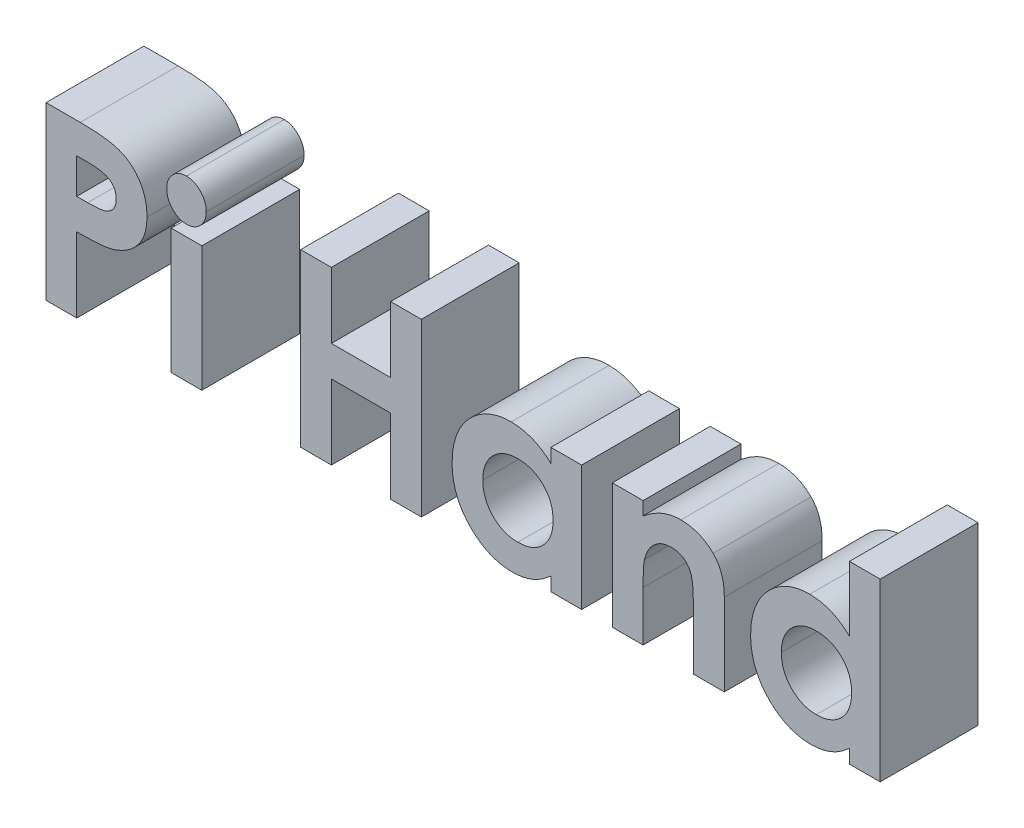
from build123d import *

# Parameters (mm, degrees)
BOSS_EXTRUDE1_DEPTH   = 2
BOSS_EXTRUDE1_2_DEPTH = 2
SKETCH1_W             = 0.628205128
SKETCH1_H             = 2.557692308
BOSS_EXTRUDE1_3_DEPTH = 2
BOSS_EXTRUDE1_4_DEPTH = 2
BOSS_EXTRUDE1_5_DEPTH = 2
BOSS_EXTRUDE1_6_DEPTH = 2
BOSS_EXTRUDE1_7_DEPTH = 2


with BuildPart() as part:
    # Sketch1 → Boss-Extrude1 (new body)
    with BuildSketch(Plane.XY):
        with BuildLine():
            Line((0.403846154, 3.5), (1.104967949, 3.5))
            add(Edge.make_bspline(
                [(1.104967949, 3.5), (1.150778337, 3.499794943), (1.239156179, 3.499399345), (1.366604298, 3.494602193), (1.484181429, 3.486005403), (1.591860556, 3.475381131), (1.689597407, 3.460486316), (1.777514377, 3.443410575), (1.85562971, 3.422607354), (1.924824273, 3.397914219), (1.986924158, 3.368801977), (2.045690679, 3.337795361), (2.099795705, 3.300790059), (2.15197008, 3.261774345), (2.199230906, 3.217021062), (2.244526596, 3.169508606), (2.285938753, 3.117352673), (2.323659267, 3.061184597), (2.357877585, 3.002042122), (2.387772997, 2.93981952), (2.412022481, 2.87441833), (2.432364783, 2.806261623), (2.448703918, 2.735352371), (2.459579766, 2.661254473), (2.466967189, 2.584485311), (2.467619027, 2.532236171), (2.467948718, 2.505809295)],
                knots=[0, 0, 0, 0, 1.698747864, 3.27724071, 4.728299578, 6.070144658, 7.288476769, 8.393259625, 9.389771311, 10.283485332, 11.113357557, 11.931608583, 12.74405601, 13.541433047, 14.344816069, 15.154114104, 15.974336324, 16.810834471, 17.661136416, 18.50621059, 19.367396281, 20.244825668, 21.142564693, 22.063065223, 23.020325768, 24, 24, 24, 24], degree=3))
            add(Edge.make_bspline(
                [(2.467948718, 2.505809295), (2.467471697, 2.476573871), (2.466534292, 2.419122669), (2.457344706, 2.334906257), (2.441645989, 2.254613532), (2.421128587, 2.177567372), (2.39251853, 2.105035358), (2.359832882, 2.035286853), (2.319619169, 1.970277391), (2.273668572, 1.909193782), (2.223485278, 1.851539387), (2.167877937, 1.798978868), (2.10790645, 1.751153923), (2.04391797, 1.707563341), (1.975672265, 1.668295054), (1.903218577, 1.632981357), (1.826062152, 1.602751692), (1.772332739, 1.586941821), (1.745092147, 1.578926282)],
                knots=[0, 0, 0, 0, 1.102006807, 2.165578795, 3.188629044, 4.184801286, 5.166646146, 6.124351954, 7.085497154, 8.042432466, 9.003981491, 9.963833307, 10.922997304, 11.89326795, 12.880200226, 13.889073926, 14.929769137, 16, 16, 16, 16], degree=3))
            add(Edge.make_bspline(
                [(1.745092147, 1.578926282), (1.727149927, 1.574462228), (1.688281298, 1.564791651), (1.623964394, 1.554973587), (1.549845916, 1.545946482), (1.465686188, 1.538188777), (1.371436693, 1.532915346), (1.267188687, 1.52879703), (1.152894927, 1.52580259), (1.073419566, 1.525696334), (1.032051282, 1.525641026)],
                knots=[0, 0, 0, 0, 0.618981996, 1.340914327, 2.176866532, 3.120127938, 4.170906482, 5.338178032, 6.614476169, 8, 8, 8, 8], degree=3))
            Line((1.032051282, 1.525641026), (1.032051282, 0))
            Line((1.032051282, 0), (0.403846154, 0))
            Line((0.403846154, 0), (0.403846154, 3.5))
        make_face()
        with BuildLine():
            Line((1.032051282, 2.153846154), (1.254306891, 2.153846154))
            add(Edge.make_bspline(
                [(1.254306891, 2.153846154), (1.294749808, 2.154102593), (1.369165376, 2.154574446), (1.470790763, 2.161397707), (1.55245888, 2.171818204), (1.616978208, 2.186763608), (1.667922329, 2.209445236), (1.711858443, 2.235683609), (1.749543571, 2.268861312), (1.782173344, 2.306772514), (1.808259865, 2.350334385), (1.826349508, 2.398837605), (1.838100185, 2.451263069), (1.839185469, 2.487747722), (1.83974359, 2.506510417)],
                knots=[0, 0, 0, 0, 1.8619151, 3.425951444, 4.686033666, 5.651700536, 6.461346321, 7.243864085, 7.999046032, 8.762387399, 9.539336099, 10.322741239, 11.137448474, 12, 12, 12, 12], degree=3))
            add(Edge.make_bspline(
                [(1.83974359, 2.506510417), (1.83919121, 2.522903138), (1.83811946, 2.554708959), (1.830246092, 2.600612649), (1.817698208, 2.643404356), (1.799516806, 2.68263718), (1.77601256, 2.718244457), (1.747356126, 2.750212159), (1.713915225, 2.779224904), (1.688096894, 2.794581793), (1.674979968, 2.802383814)],
                knots=[0, 0, 0, 0, 1.102301479, 2.1387299, 3.123554645, 4.094223062, 5.036071848, 5.982632524, 6.975082478, 8, 8, 8, 8], degree=3))
            add(Edge.make_bspline(
                [(1.674979968, 2.802383814), (1.663869174, 2.808002861), (1.640345348, 2.819899535), (1.60028199, 2.833730288), (1.554049488, 2.845398051), (1.501335718, 2.855082183), (1.442350972, 2.862598074), (1.377105774, 2.868345851), (1.305504108, 2.870657256), (1.255709434, 2.871405207), (1.229767628, 2.871794872)],
                knots=[0, 0, 0, 0, 0.656809284, 1.390599849, 2.23162475, 3.173112763, 4.218524733, 5.370385145, 6.63003504, 8, 8, 8, 8], degree=3))
            Line((1.229767628, 2.871794872), (1.032051282, 2.871794872))
            Line((1.032051282, 2.871794872), (1.032051282, 2.153846154))
        make_face(mode=Mode.SUBTRACT)
    extrude(amount=BOSS_EXTRUDE1_DEPTH)


with BuildPart() as body_2:
    # Sketch1 → Boss-Extrude1 2 (new body)
    with BuildSketch(Plane.XY):
        with BuildLine():
            add(Edge.make_bspline(
                [(3.274238782, 3.634615385), (3.301314419, 3.633286951), (3.35448004, 3.630678445), (3.430647027, 3.605251308), (3.500552884, 3.565344177), (3.562351601, 3.510590642), (3.613749995, 3.445204906), (3.653020277, 3.372001228), (3.674896115, 3.29089391), (3.677934345, 3.234865823), (3.679487179, 3.206229968)],
                knots=[0, 0, 0, 0, 0.989868614, 1.943702388, 2.910836514, 3.924849579, 4.949916355, 5.946401046, 6.950409252, 8, 8, 8, 8], degree=3))
            add(Edge.make_bspline(
                [(3.679487179, 3.206229968), (3.677989903, 3.177805144), (3.675072389, 3.12241802), (3.652516791, 3.042411771), (3.614822682, 2.969243648), (3.563007993, 2.904829012), (3.501879255, 2.850957315), (3.433500894, 2.810325694), (3.358063808, 2.786313063), (3.305723156, 2.7834865), (3.279146635, 2.782051282)],
                knots=[0, 0, 0, 0, 1.05296456, 2.051751585, 3.055639087, 4.085634717, 5.099016424, 6.062201612, 7.016062274, 8, 8, 8, 8], degree=3))
            add(Edge.make_bspline(
                [(3.279146635, 2.782051282), (3.25183465, 2.783374966), (3.19820649, 2.785974073), (3.121414777, 2.811460703), (3.050576554, 2.85105354), (2.98904592, 2.906925775), (2.937058899, 2.972776125), (2.899503959, 3.047684049), (2.876012415, 3.129345977), (2.873223989, 3.186203877), (2.871794872, 3.215344551)],
                knots=[0, 0, 0, 0, 0.989065327, 1.942068821, 2.907541208, 3.917690034, 4.939857478, 5.938239964, 6.943311734, 8, 8, 8, 8], degree=3))
            add(Edge.make_bspline(
                [(2.871794872, 3.215344551), (2.873350142, 3.243286705), (2.876405246, 3.298175033), (2.898412123, 3.377479097), (2.936781938, 3.449452107), (2.987810104, 3.513640896), (3.04906602, 3.567373072), (3.118929913, 3.606068197), (3.194584293, 3.630445121), (3.247413129, 3.633210943), (3.274238782, 3.634615385)],
                knots=[0, 0, 0, 0, 1.038616768, 2.040212704, 3.031499824, 4.052181184, 5.074969369, 6.039807101, 7.004644834, 8, 8, 8, 8], degree=3))
        make_face()
    extrude(amount=BOSS_EXTRUDE1_2_DEPTH)


with BuildPart() as body_3:
    # Sketch1 → Boss-Extrude1 3 (new body)
    with BuildSketch(Plane.XY):
        with Locations((3.275641026, 1.278846154)):
            Rectangle(SKETCH1_W, SKETCH1_H)
    extrude(amount=BOSS_EXTRUDE1_3_DEPTH)


with BuildPart() as body_4:
    # Sketch1 → Boss-Extrude1 4 (new body)
    with BuildSketch(Plane.XY):
        Polygon((5.608974359, 3.5), (6.237179487, 3.5), (6.237179487, 2.153846154), (7.448717949, 2.153846154), (7.448717949, 3.5), (8.076923077, 3.5), (8.076923077, 0), (7.448717949, 0), (7.448717949, 1.525641026), (6.237179487, 1.525641026), (6.237179487, 0), (5.608974359, 0), align=None)
    extrude(amount=BOSS_EXTRUDE1_4_DEPTH)


with BuildPart() as body_5:
    # Sketch1 → Boss-Extrude1 5 (new body)
    with BuildSketch(Plane.XY):
        with BuildLine():
            Line((10.724358974, 2.557692308), (11.352564103, 2.557692308))
            Line((11.352564103, 2.557692308), (11.352564103, 0))
            Line((11.352564103, 0), (10.724358974, 0))
            Line((10.724358974, 0), (10.724358974, 0.279046474))
            add(Edge.make_bspline(
                [(10.724358974, 0.279046474), (10.693231642, 0.251884388), (10.632819636, 0.199168144), (10.537629863, 0.130767476), (10.442161935, 0.074345765), (10.345957125, 0.029408949), (10.247536807, -0.003772264), (10.146192392, -0.027796237), (10.040464414, -0.041963762), (9.968591991, -0.043892353), (9.932091346, -0.044871795)],
                knots=[0, 0, 0, 0, 1.129196829, 2.191548051, 3.199897424, 4.157751732, 5.089409408, 6.034969131, 7.002052659, 8, 8, 8, 8], degree=3))
            add(Edge.make_bspline(
                [(9.932091346, -0.044871795), (9.89111775, -0.043950017), (9.810151602, -0.042128532), (9.691342768, -0.022954463), (9.576621028, 0.006395724), (9.466079503, 0.047929908), (9.359919313, 0.101750066), (9.257328011, 0.166451958), (9.160064326, 0.244307005), (9.067318569, 0.331946618), (8.98240111, 0.428350817), (8.908165466, 0.532181523), (8.845590335, 0.641966128), (8.794325879, 0.757340645), (8.753999764, 0.878220396), (8.725253014, 1.004988774), (8.708292399, 1.137691055), (8.706193153, 1.228082651), (8.705128205, 1.273938301)],
                knots=[0, 0, 0, 0, 0.980476535, 1.937477201, 2.874147792, 3.812856188, 4.758993464, 5.720109578, 6.712210464, 7.737600662, 8.772720504, 9.783789959, 10.789002326, 11.793715968, 12.802552247, 13.835794126, 14.902098527, 16, 16, 16, 16], degree=3))
            add(Edge.make_bspline(
                [(8.705128205, 1.273938301), (8.706245871, 1.321421887), (8.708438299, 1.414566232), (8.724475772, 1.551251128), (8.752692036, 1.681162718), (8.79116694, 1.804480946), (8.840658223, 1.921227119), (8.900935299, 2.031592502), (8.972818181, 2.13528862), (9.05565046, 2.23055049), (9.145088976, 2.317862595), (9.240772378, 2.393874707), (9.341204385, 2.458450533), (9.446491724, 2.511169467), (9.55661936, 2.551907991), (9.67115251, 2.581691179), (9.790599622, 2.599562137), (9.871967962, 2.601555137), (9.913161058, 2.602564103)],
                knots=[0, 0, 0, 0, 1.136281865, 2.228943489, 3.287578264, 4.313574083, 5.316051562, 6.317280042, 7.318008486, 8.329309503, 9.333984563, 10.305318864, 11.248632312, 12.186624717, 13.117503092, 14.05354244, 15.014596925, 16, 16, 16, 16], degree=3))
            add(Edge.make_bspline(
                [(9.913161058, 2.602564103), (9.951319212, 2.601771359), (10.026820445, 2.600202805), (10.137796379, 2.583171311), (10.245427029, 2.557412387), (10.349125264, 2.520710555), (10.449741652, 2.474367027), (10.545545527, 2.416295131), (10.638632686, 2.348935605), (10.69543049, 2.296326387), (10.724358974, 2.26953125)],
                knots=[0, 0, 0, 0, 1.017011718, 2.012299608, 2.98747302, 3.965332399, 4.941441765, 5.936729654, 6.94912688, 8, 8, 8, 8], degree=3))
            Line((10.724358974, 2.26953125), (10.724358974, 2.557692308))
        make_face()
        with BuildLine():
            add(Edge.make_bspline(
                [(10.044971955, 2.019230769), (10.019939833, 2.018462697), (9.970878507, 2.016957326), (9.898727113, 2.007902416), (9.829772026, 1.99194726), (9.764505026, 1.968376944), (9.701953397, 1.939664864), (9.643066993, 1.903703457), (9.587359809, 1.861197838), (9.535159463, 1.813177067), (9.487571157, 1.76039346), (9.44654726, 1.702795109), (9.411683575, 1.641933961), (9.382197958, 1.577627029), (9.361092946, 1.509113362), (9.344377786, 1.437284886), (9.3357037, 1.3615548), (9.334131361, 1.309947091), (9.333333333, 1.283754006)],
                knots=[0, 0, 0, 0, 1.04836806, 2.054732945, 3.03993516, 4.00574415, 4.955904794, 5.917688631, 6.888591924, 7.88601754, 8.884115178, 9.859153345, 10.841239365, 11.818093293, 12.814750328, 13.83810466, 14.90274714, 16, 16, 16, 16], degree=3))
            add(Edge.make_bspline(
                [(9.333333333, 1.283754006), (9.334119171, 1.257323336), (9.335667655, 1.205242005), (9.344518037, 1.128873109), (9.360631717, 1.055995388), (9.384140969, 0.98719801), (9.412851219, 0.92155267), (9.447798049, 0.859362327), (9.490724109, 0.801726584), (9.538354131, 0.747281587), (9.591625359, 0.698664318), (9.647647757, 0.655496646), (9.707186547, 0.619378283), (9.769595776, 0.590187194), (9.834665371, 0.566398909), (9.903211108, 0.550644277), (9.974561495, 0.540572639), (10.023202938, 0.539170098), (10.047776442, 0.538461538)],
                knots=[0, 0, 0, 0, 1.099136573, 2.165835871, 3.191374663, 4.196217796, 5.183857741, 6.167377911, 7.154730987, 8.166690795, 9.170734848, 10.148332609, 11.103258353, 12.059567475, 13.009337315, 13.978056681, 14.978520572, 16, 16, 16, 16], degree=3))
            add(Edge.make_bspline(
                [(10.047776442, 0.538461538), (10.073274817, 0.539233916), (10.123265494, 0.540748197), (10.196594001, 0.549720472), (10.266475403, 0.565734128), (10.332618955, 0.58943939), (10.396034938, 0.617945374), (10.45615108, 0.653204068), (10.512315029, 0.695612148), (10.564811229, 0.744067028), (10.612913878, 0.797281645), (10.654505103, 0.855635307), (10.690732582, 0.917261705), (10.719223828, 0.98361791), (10.741849872, 1.053543), (10.758083537, 1.127470944), (10.766913709, 1.205481445), (10.768448651, 1.258726651), (10.769230769, 1.285857372)],
                knots=[0, 0, 0, 0, 1.050008698, 2.058587853, 3.036635738, 3.995319155, 4.947022481, 5.895997462, 6.858296291, 7.838991643, 8.833936038, 9.806048392, 10.784806122, 11.771666913, 12.772873988, 13.80724452, 14.882696879, 16, 16, 16, 16], degree=3))
            add(Edge.make_bspline(
                [(10.769230769, 1.285857372), (10.768458369, 1.312521457), (10.766949648, 1.36460416), (10.758045455, 1.440985838), (10.74169654, 1.513462175), (10.719536177, 1.58216639), (10.690538064, 1.646941393), (10.654283174, 1.707068983), (10.61314818, 1.764632355), (10.564512966, 1.81640935), (10.512301149, 1.86451338), (10.455311218, 1.905639009), (10.395338666, 1.941082217), (10.33201502, 1.970182458), (10.264753932, 1.991514038), (10.194753107, 2.0080303), (10.120920389, 2.016951892), (10.07070123, 2.018458747), (10.044971955, 2.019230769)],
                knots=[0, 0, 0, 0, 1.106611376, 2.161533483, 3.185006901, 4.184773755, 5.152708835, 6.122342771, 7.094156588, 8.082475533, 9.064254463, 10.03606828, 10.992420271, 11.951521816, 12.920622147, 13.915721683, 14.932141191, 16, 16, 16, 16], degree=3))
        make_face(mode=Mode.SUBTRACT)
    extrude(amount=BOSS_EXTRUDE1_5_DEPTH)


with BuildPart() as body_6:
    # Sketch1 → Boss-Extrude1 6 (new body)
    with BuildSketch(Plane.XY):
        with BuildLine():
            Line((11.980769231, 2.557692308), (12.608974359, 2.557692308))
            Line((12.608974359, 2.557692308), (12.608974359, 2.287059295))
            add(Edge.make_bspline(
                [(12.608974359, 2.287059295), (12.64481315, 2.314935445), (12.713308047, 2.368212186), (12.817432116, 2.436140303), (12.915712346, 2.491736739), (13.010339508, 2.534026233), (13.103094014, 2.564451706), (13.195478092, 2.586310593), (13.288867525, 2.600307439), (13.351647893, 2.601812285), (13.383012821, 2.602564103)],
                knots=[0, 0, 0, 0, 1.276643801, 2.439914479, 3.493451431, 4.44993799, 5.350072675, 6.235028322, 7.118224225, 8, 8, 8, 8], degree=3))
            add(Edge.make_bspline(
                [(13.383012821, 2.602564103), (13.414828318, 2.601704931), (13.477284812, 2.600018304), (13.569248558, 2.588221719), (13.657110986, 2.5667364), (13.741860037, 2.538209707), (13.822633111, 2.500556109), (13.900419726, 2.45584857), (13.973549054, 2.401391763), (14.018585332, 2.359920073), (14.041366186, 2.338942308)],
                knots=[0, 0, 0, 0, 1.048836932, 2.058954983, 3.049370783, 4.026390553, 5.001981509, 5.982488534, 6.97947532, 8, 8, 8, 8], degree=3))
            add(Edge.make_bspline(
                [(14.041366186, 2.338942308), (14.059637269, 2.319502053), (14.096313158, 2.280479265), (14.142465156, 2.213701279), (14.182068761, 2.140901052), (14.214518413, 2.061238809), (14.238497398, 1.974276857), (14.256944759, 1.881065574), (14.267295894, 1.781083044), (14.268573791, 1.71239599), (14.269230769, 1.677083333)],
                knots=[0, 0, 0, 0, 0.889584746, 1.785680191, 2.700364693, 3.65222533, 4.649950538, 5.707241244, 6.821271309, 8, 8, 8, 8], degree=3))
            Line((14.269230769, 1.677083333), (14.269230769, 0))
            Line((14.269230769, 0), (13.641025641, 0))
            Line((13.641025641, 0), (13.641025641, 1.110576923))
            add(Edge.make_bspline(
                [(13.641025641, 1.110576923), (13.64089279, 1.146802008), (13.640638204, 1.216220658), (13.638683553, 1.31556918), (13.634866934, 1.405293797), (13.631388186, 1.485557872), (13.62455802, 1.556076413), (13.618398466, 1.617295857), (13.608947228, 1.668660815), (13.596649633, 1.723911535), (13.575175005, 1.783067534), (13.541836691, 1.845398153), (13.499542365, 1.898349402), (13.450019496, 1.942292498), (13.393322777, 1.977055518), (13.330137307, 2.001513467), (13.260801834, 2.016756262), (13.212489691, 2.018384947), (13.18739984, 2.019230769)],
                knots=[0, 0, 0, 0, 1.49886392, 2.872294502, 4.110984203, 5.214877267, 6.195405875, 7.042225351, 7.75923308, 8.355011229, 9.382752534, 10.352059385, 11.267231453, 12.171456522, 13.078624015, 14.003401117, 14.963110155, 16, 16, 16, 16], degree=3))
            add(Edge.make_bspline(
                [(13.18739984, 2.019230769), (13.154769432, 2.017576073), (13.090938012, 2.014339164), (12.998618632, 1.989929922), (12.913824819, 1.948416985), (12.837249409, 1.890971429), (12.76962172, 1.820047771), (12.71392176, 1.735463173), (12.66823635, 1.639259079), (12.648590945, 1.569014464), (12.638421474, 1.532652244)],
                knots=[0, 0, 0, 0, 0.984188326, 1.925263693, 2.85911992, 3.81709677, 4.80007086, 5.801799564, 6.862098548, 8, 8, 8, 8], degree=3))
            add(Edge.make_bspline(
                [(12.638421474, 1.532652244), (12.635893957, 1.521232445), (12.630257085, 1.495763997), (12.62562147, 1.452737838), (12.619172994, 1.401691466), (12.616756909, 1.341701086), (12.612555602, 1.273050607), (12.611001758, 1.195649206), (12.609445134, 1.109648654), (12.609136483, 1.049580536), (12.608974359, 1.018028846)],
                knots=[0, 0, 0, 0, 0.543362196, 1.211806945, 2.009705693, 2.934833164, 4.000995085, 5.207458376, 6.533175157, 8, 8, 8, 8], degree=3))
            Line((12.608974359, 1.018028846), (12.608974359, 0))
            Line((12.608974359, 0), (11.980769231, 0))
            Line((11.980769231, 0), (11.980769231, 2.557692308))
        make_face()
    extrude(amount=BOSS_EXTRUDE1_6_DEPTH)


with BuildPart() as body_7:
    # Sketch1 → Boss-Extrude1 7 (new body)
    with BuildSketch(Plane.XY):
        with BuildLine():
            Line((16.826923077, 3.58974359), (17.455128205, 3.58974359))
            Line((17.455128205, 3.58974359), (17.455128205, 0))
            Line((17.455128205, 0), (16.826923077, 0))
            Line((16.826923077, 0), (16.826923077, 0.279046474))
            add(Edge.make_bspline(
                [(16.826923077, 0.279046474), (16.795795744, 0.251884388), (16.735383739, 0.199168144), (16.640193966, 0.130767476), (16.544726038, 0.074345765), (16.448521228, 0.029408949), (16.350100909, -0.003772264), (16.248756494, -0.027796237), (16.143028516, -0.041963762), (16.071156093, -0.043892353), (16.034655449, -0.044871795)],
                knots=[0, 0, 0, 0, 1.129196829, 2.191548051, 3.199897424, 4.157751732, 5.089409408, 6.034969131, 7.002052659, 8, 8, 8, 8], degree=3))
            add(Edge.make_bspline(
                [(16.034655449, -0.044871795), (15.993681853, -0.043950017), (15.912715704, -0.042128532), (15.793906871, -0.022954463), (15.67918513, 0.006395724), (15.568643605, 0.047929908), (15.462483415, 0.101750066), (15.359892114, 0.166451958), (15.262628428, 0.244307005), (15.169882671, 0.331946618), (15.084965212, 0.428350817), (15.010729568, 0.532181523), (14.948154438, 0.641966128), (14.896889981, 0.757340645), (14.856563866, 0.878220396), (14.827817117, 1.004988774), (14.810856501, 1.137691055), (14.808757255, 1.228082651), (14.807692308, 1.273938301)],
                knots=[0, 0, 0, 0, 0.980476535, 1.937477201, 2.874147792, 3.812856188, 4.758993464, 5.720109578, 6.712210464, 7.737600662, 8.772720504, 9.783789959, 10.789002326, 11.793715968, 12.802552247, 13.835794126, 14.902098527, 16, 16, 16, 16], degree=3))
            add(Edge.make_bspline(
                [(14.807692308, 1.273938301), (14.808809974, 1.321421887), (14.811002401, 1.414566232), (14.827039874, 1.551251128), (14.855256138, 1.681162718), (14.893731042, 1.804480946), (14.943222325, 1.921227119), (15.003499402, 2.031592502), (15.075382284, 2.13528862), (15.158214563, 2.23055049), (15.247653079, 2.317862595), (15.34333648, 2.393874707), (15.443768487, 2.458450533), (15.549055827, 2.511169467), (15.659183462, 2.551907991), (15.773716613, 2.581691179), (15.893163724, 2.599562137), (15.974532064, 2.601555137), (16.01572516, 2.602564103)],
                knots=[0, 0, 0, 0, 1.136281865, 2.228943489, 3.287578264, 4.313574083, 5.316051562, 6.317280042, 7.318008486, 8.329309503, 9.333984563, 10.305318864, 11.248632312, 12.186624717, 13.117503092, 14.05354244, 15.014596925, 16, 16, 16, 16], degree=3))
            add(Edge.make_bspline(
                [(16.01572516, 2.602564103), (16.053858714, 2.601354246), (16.129267819, 2.598961754), (16.240660056, 2.583901614), (16.347840544, 2.555544685), (16.452110986, 2.519008867), (16.55211723, 2.469844118), (16.648396565, 2.410785484), (16.741202671, 2.341082936), (16.797988381, 2.287180892), (16.826923077, 2.259715545)],
                knots=[0, 0, 0, 0, 1.011899165, 2.001030639, 2.974036179, 3.948778736, 4.92769327, 5.924124564, 6.942254589, 8, 8, 8, 8], degree=3))
            Line((16.826923077, 2.259715545), (16.826923077, 3.58974359))
        make_face()
        with BuildLine():
            add(Edge.make_bspline(
                [(16.147536058, 2.019230769), (16.122503935, 2.018462697), (16.073442609, 2.016957326), (16.001291216, 2.007902416), (15.932336128, 1.99194726), (15.867069129, 1.968376944), (15.804517499, 1.939664864), (15.745631096, 1.903703457), (15.689923911, 1.861197838), (15.637723566, 1.813177067), (15.59013526, 1.76039346), (15.549111362, 1.702795109), (15.514247677, 1.641933961), (15.484762061, 1.577627029), (15.463657049, 1.509113362), (15.446941888, 1.437284886), (15.438267802, 1.3615548), (15.436695464, 1.309947091), (15.435897436, 1.283754006)],
                knots=[0, 0, 0, 0, 1.04836806, 2.054732945, 3.03993516, 4.00574415, 4.955904794, 5.917688631, 6.888591924, 7.88601754, 8.884115178, 9.859153345, 10.841239365, 11.818093293, 12.814750328, 13.83810466, 14.90274714, 16, 16, 16, 16], degree=3))
            add(Edge.make_bspline(
                [(15.435897436, 1.283754006), (15.436683274, 1.257323336), (15.438231758, 1.205242005), (15.44708214, 1.128873109), (15.46319582, 1.055995388), (15.486705072, 0.98719801), (15.515415321, 0.92155267), (15.550362151, 0.859362327), (15.593288211, 0.801726584), (15.640918234, 0.747281587), (15.694189461, 0.698664318), (15.750211859, 0.655496646), (15.80975065, 0.619378283), (15.872159879, 0.590187194), (15.937229474, 0.566398909), (16.005775211, 0.550644277), (16.077125598, 0.540572639), (16.12576704, 0.539170098), (16.150340545, 0.538461538)],
                knots=[0, 0, 0, 0, 1.099136573, 2.165835871, 3.191374663, 4.196217796, 5.183857741, 6.167377911, 7.154730987, 8.166690795, 9.170734848, 10.148332609, 11.103258353, 12.059567475, 13.009337315, 13.978056681, 14.978520572, 16, 16, 16, 16], degree=3))
            add(Edge.make_bspline(
                [(16.150340545, 0.538461538), (16.17583892, 0.539233916), (16.225829597, 0.540748197), (16.299158103, 0.549720472), (16.369039505, 0.565734128), (16.435183058, 0.58943939), (16.498599041, 0.617945374), (16.558715182, 0.653204068), (16.614879131, 0.695612148), (16.667375332, 0.744067028), (16.71547798, 0.797281645), (16.757069206, 0.855635307), (16.793296685, 0.917261705), (16.82178793, 0.98361791), (16.844413974, 1.053543), (16.860647639, 1.127470944), (16.869477812, 1.205481445), (16.871012753, 1.258726651), (16.871794872, 1.285857372)],
                knots=[0, 0, 0, 0, 1.050008698, 2.058587853, 3.036635738, 3.995319155, 4.947022481, 5.895997462, 6.858296291, 7.838991643, 8.833936038, 9.806048392, 10.784806122, 11.771666913, 12.772873988, 13.80724452, 14.882696879, 16, 16, 16, 16], degree=3))
            add(Edge.make_bspline(
                [(16.871794872, 1.285857372), (16.871022472, 1.312521457), (16.86951375, 1.36460416), (16.860609557, 1.440985838), (16.844260642, 1.513462175), (16.822100279, 1.58216639), (16.793102166, 1.646941393), (16.756847276, 1.707068983), (16.715712283, 1.764632355), (16.667077069, 1.81640935), (16.614865252, 1.86451338), (16.557875321, 1.905639009), (16.497902769, 1.941082217), (16.434579123, 1.970182458), (16.367318034, 1.991514038), (16.29731721, 2.0080303), (16.223484491, 2.016951892), (16.173265333, 2.018458747), (16.147536058, 2.019230769)],
                knots=[0, 0, 0, 0, 1.106611376, 2.161533483, 3.185006901, 4.184773755, 5.152708835, 6.122342771, 7.094156588, 8.082475533, 9.064254463, 10.03606828, 10.992420271, 11.951521816, 12.920622147, 13.915721683, 14.932141191, 16, 16, 16, 16], degree=3))
        make_face(mode=Mode.SUBTRACT)
    extrude(amount=BOSS_EXTRUDE1_7_DEPTH)


solid = Compound([part.part, body_2.part, body_3.part, body_4.part, body_5.part, body_6.part, body_7.part])
